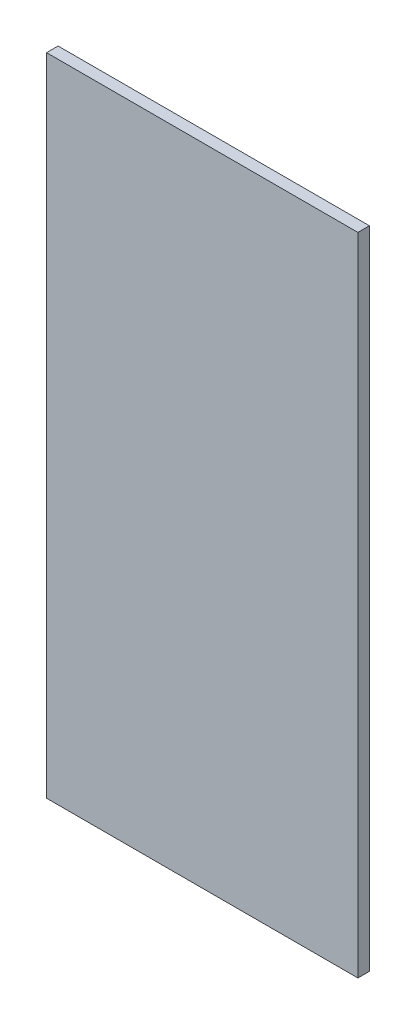
from build123d import *

# Parameters (mm, degrees)
SKETCH1_W           = 342.9
SKETCH1_H           = 711.2
BOSS_EXTRUDE1_DEPTH = 12.7


with BuildPart() as part:
    # Sketch1 → Boss-Extrude1 (new body)
    with BuildSketch(Plane.XY):
        Rectangle(SKETCH1_W, SKETCH1_H)
    extrude(amount=BOSS_EXTRUDE1_DEPTH)


solid = part.part
